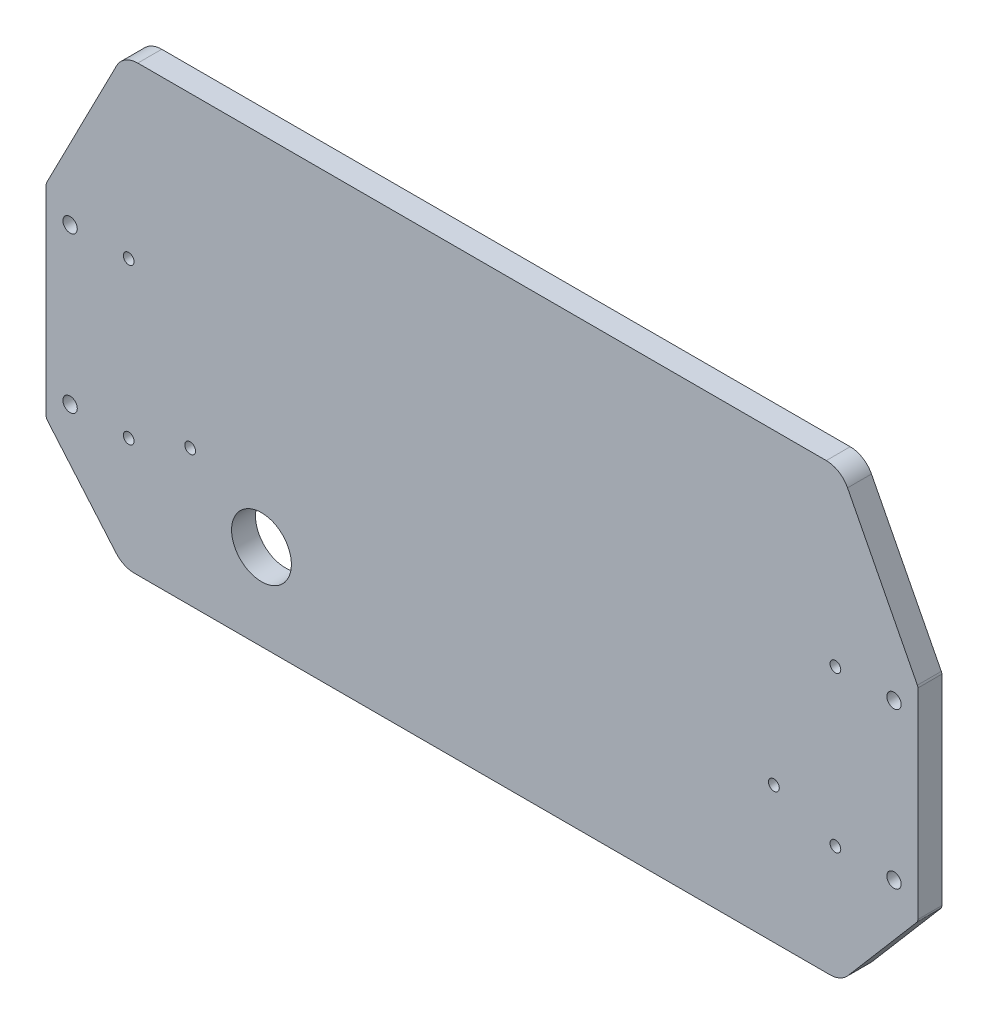
from build123d import *

# Parameters (mm, degrees)
ESQUISSE1_W             = 364.4
ESQUISSE1_H             = 85
ESQUISSE1_W_2           = 300
ESQUISSE1_H_2           = 62.7
ESQUISSE1_H_3           = 37.7
BOSS_EXTRU_1_DEPTH      = 10
ESQUISSE3_R             = 2.25
ESQUISSE3_R_2           = 3
ENL_V_MAT_EXTRU_1_DEPTH = 10
ESQUISSE4_R             = 2.25
ENL_V_MAT_EXTRU_2_DEPTH = 10
CONG_1_R                = 10
CONG_2_R                = 2
ESQUISSE5_R             = 12.5
ENL_V_MAT_EXTRU_3_DEPTH = 10


with BuildPart() as part:
    # Esquisse1 → Boss.-Extru.1 (new body)
    with BuildSketch(Plane.XY):
        Rectangle(ESQUISSE1_W, ESQUISSE1_H)
        with Locations((0, 73.85)):
            Rectangle(ESQUISSE1_W_2, ESQUISSE1_H_2)
        Polygon((-150, 105.2), (-182.2, 42.5), (-150, 42.5), align=None)
        with Locations((0, -61.35)):
            Rectangle(ESQUISSE1_W_2, ESQUISSE1_H_3)
        Polygon((-150, -42.5), (-182.2, -42.5), (-150, -80.2), align=None)
        Polygon((182.2, 42.5), (150, 105.2), (150, 42.5), align=None)
        Polygon((182.2, -42.5), (150, -42.5), (150, -80.2), align=None)
    extrude(amount=BOSS_EXTRU_1_DEPTH)

    # Esquisse3 → Enlèv. mat.-Extru.1 (cut)
    with BuildSketch(Plane.XY.offset(10)):
        with Locations((-147.7, 32.5)):
            Circle(ESQUISSE3_R)
        with Locations((-172.2, 32.5)):
            Circle(ESQUISSE3_R_2)
        with Locations((-172.2, -32.5)):
            Circle(ESQUISSE3_R_2)
        with Locations((-147.7, -32.5)):
            Circle(ESQUISSE3_R)
        with Locations((172.2, -32.5)):
            Circle(ESQUISSE3_R_2)
        with Locations((147.7, -32.5)):
            Circle(ESQUISSE3_R)
        with Locations((172.2, 32.5)):
            Circle(ESQUISSE3_R_2)
        with Locations((147.7, 32.5)):
            Circle(ESQUISSE3_R)
    extrude(amount=-ENL_V_MAT_EXTRU_1_DEPTH, mode=Mode.SUBTRACT)

    # Esquisse4 → Enlèv. mat.-Extru.2 (cut)
    with BuildSketch(Plane.XY.offset(10)):
        with Locations((-122, -23.2)):
            Circle(ESQUISSE4_R)
        with Locations((122, -23.2)):
            Circle(ESQUISSE4_R)
    extrude(amount=-ENL_V_MAT_EXTRU_2_DEPTH, mode=Mode.SUBTRACT)

    # Congé1
    cong_1_edges = [part.edges().sort_by_distance(p)[0] for p in [
        (-150, -80.2, 5),
        (-150, 105.2, 5),
        (150, 105.2, 5),
        (150, -80.2, 5),
    ]]
    fillet(cong_1_edges, radius=CONG_1_R)

    # Congé2
    cong_2_edges = [part.edges().sort_by_distance(p)[0] for p in [
        (-182.2, -42.5, 5),
        (-182.2, 42.5, 5),
        (182.2, 42.5, 5),
        (182.2, -42.5, 5),
    ]]
    fillet(cong_2_edges, radius=CONG_2_R)

    # Esquisse5 → Enlèv. mat.-Extru.3 (cut)
    with BuildSketch(Plane(origin=(0, 0, 0), x_dir=(-1, 0, 0), z_dir=(0, 0, -1))):
        with Locations((92.2, -44.2)):
            Circle(ESQUISSE5_R)
    extrude(amount=-ENL_V_MAT_EXTRU_3_DEPTH, mode=Mode.SUBTRACT)


solid = part.part
